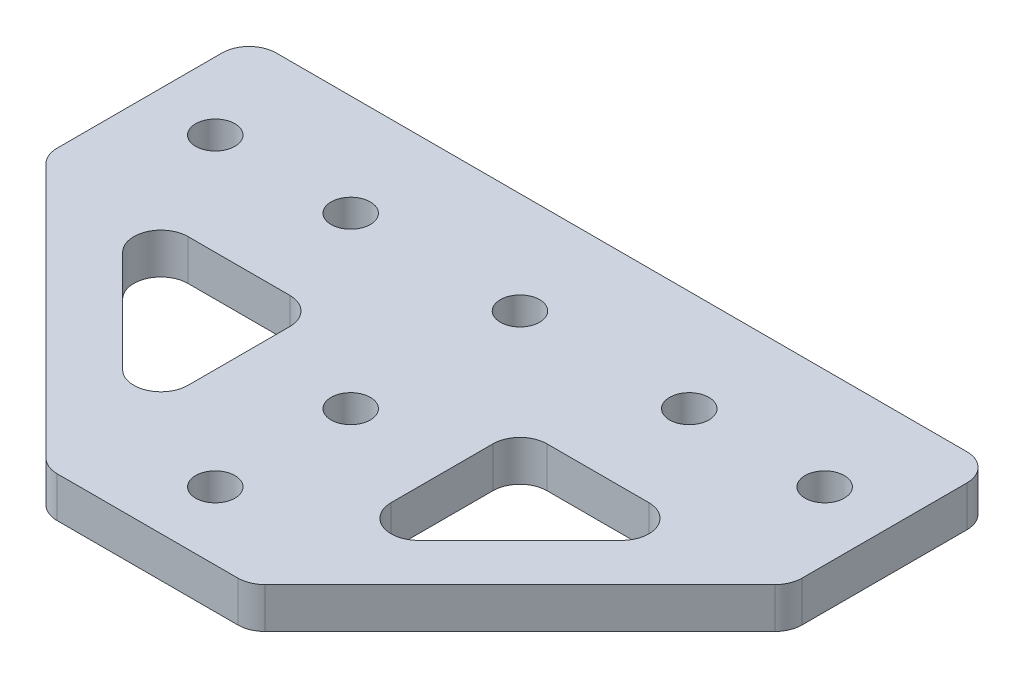
from build123d import *

# Parameters (mm, degrees)
SKETCH_1_R      = 1.45
SKETCH_1_W      = 20
SKETCH_1_H      = 15
EXTRUDE_1_DEPTH = 3
EXTRUDE_2_DEPTH = 3
FILLET_1_R      = 2


with BuildPart() as part:
    # 草图1 → 凸台-拉伸1 (new body)
    # profile 1 of 2: a face of its own
    with BuildSketch(Plane(origin=(0, 0, 0), x_dir=(1, 0, 0), z_dir=(0, 1, 0))):
        Polygon((-15, -35), (-15, -15), (-35, -15), (-35, 0), (0, 0), (0, -35), align=None)
        with Locations(Location((-7.5, -30, 0), (0, 0, 270))):
            Circle(SKETCH_1_R, mode=Mode.SUBTRACT)
        with Locations(Location((-7.5, -20, 0), (0, 0, 270))):
            Circle(SKETCH_1_R, mode=Mode.SUBTRACT)
        with Locations(Location((-30, -7.5, 0), (0, 0, 270))):
            Circle(SKETCH_1_R, mode=Mode.SUBTRACT)
        with Locations(Location((-20, -7.5, 0), (0, 0, 270))):
            Circle(SKETCH_1_R, mode=Mode.SUBTRACT)
        with Locations(Location((-7.5, -7.5, 0), (0, 0, 270))):
            Circle(SKETCH_1_R, mode=Mode.SUBTRACT)
    # profile 2 of 2: a face of its own
    with BuildSketch(Plane(origin=(0, 0, 0), x_dir=(1, 0, 0), z_dir=(0, 1, 0))):
        with Locations((10, -7.5)):
            Rectangle(SKETCH_1_W, SKETCH_1_H)
        with Locations(Location((5, -7.5, 0), (0, 0, 270))):
            Circle(SKETCH_1_R, mode=Mode.SUBTRACT)
        with Locations(Location((15, -7.5, 0), (0, 0, 270))):
            Circle(SKETCH_1_R, mode=Mode.SUBTRACT)
    extrude(amount=EXTRUDE_1_DEPTH)

    # 草图2 → 凸台-拉伸2 (add)
    with BuildSketch(Plane(origin=(0, 3, 0), x_dir=(1, 0, 0), z_dir=(0, 1, 0))):
        Polygon((-35, -15), (-15, -35), (-15, -29.343145751), (-29.343145751, -15), align=None)
        Polygon((14.343145751, -15), (20, -15), (0, -35), (0, -29.343145751), align=None)
    extrude(amount=-EXTRUDE_2_DEPTH)

    # 圆角1
    fillet_1_edges = [part.edges().sort_by_distance(p)[0] for p in [
        (-15, 1.5, 15),
        (-35, 1.5, 15),
        (-35, 1.5, 0),
        (20, 1.5, 0),
        (20, 1.5, 15),
        (0, 1.5, 15),
        (0, 1.5, 35),
        (-15, 1.5, 35),
        (0, 1.5, 29.343145751),
        (14.343145751, 1.5, 15),
        (-29.343145751, 1.5, 15),
        (-15, 1.5, 29.343145751),
    ]]
    fillet(fillet_1_edges, radius=FILLET_1_R)


solid = part.part
